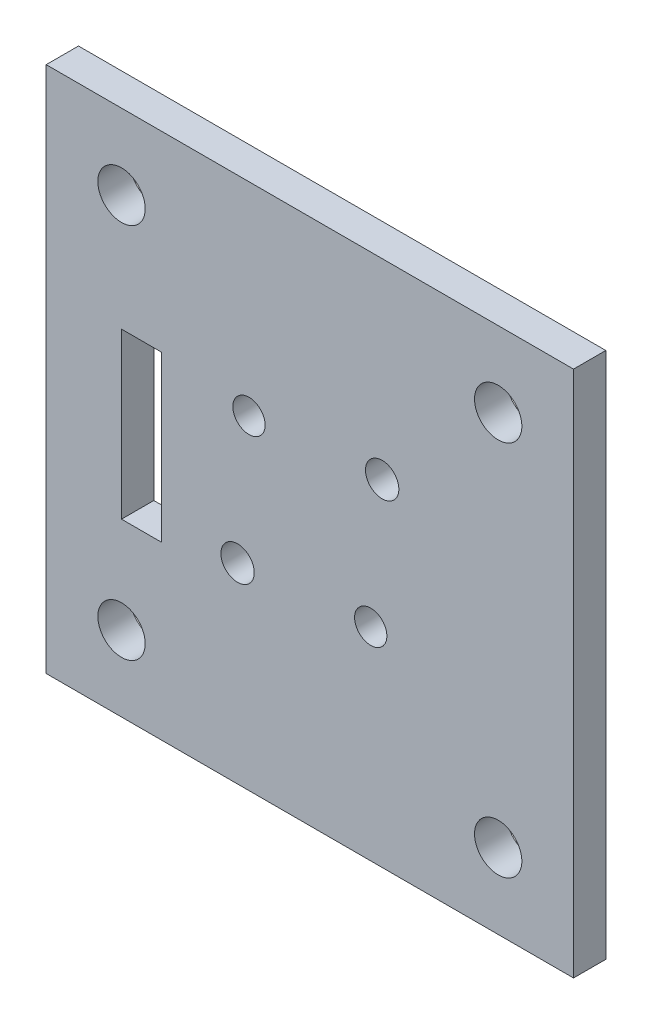
from build123d import *

# Parameters (mm, degrees)
SKETCH1_W           = 49
SKETCH1_H           = 49
SKETCH1_R           = 2.2
BOSS_EXTRUDE1_DEPTH = 3
SKETCH2_R           = 1.55
SKETCH2_R_2         = 1.5
SKETCH2_W           = 3.699471197
SKETCH2_H           = 15.29419199
CUT_EXTRUDE1_DEPTH  = 3


with BuildPart() as part:
    # Sketch1 → Boss-Extrude1 (new body)
    with BuildSketch(Plane.XY):
        Rectangle(SKETCH1_W, SKETCH1_H)
        with Locations((-17.5, -17.5)):
            Circle(SKETCH1_R, mode=Mode.SUBTRACT)
        with Locations((17.5, 17.5)):
            Circle(SKETCH1_R, mode=Mode.SUBTRACT)
        with Locations((17.5, -17.5)):
            Circle(SKETCH1_R, mode=Mode.SUBTRACT)
        with Locations((-17.5, 17.5)):
            Circle(SKETCH1_R, mode=Mode.SUBTRACT)
    extrude(amount=BOSS_EXTRUDE1_DEPTH)

    # Sketch2 → Cut-Extrude1 (cut)
    with BuildSketch(Plane(origin=(0, 0, 0), x_dir=(-1, 0, 0), z_dir=(0, 0, -1))):
        with Locations((-6.717514421, 6.717514421)):
            Circle(SKETCH2_R)
        with Locations((5.656854249, 5.656854249)):
            Circle(SKETCH2_R_2)
        with Locations((6.717514421, -6.717514421)):
            Circle(SKETCH2_R)
        with Locations((-5.656854249, -5.656854249)):
            Circle(SKETCH2_R_2)
        with Locations((15.650264401, -0.929581574)):
            Rectangle(SKETCH2_W, SKETCH2_H)
    extrude(amount=-CUT_EXTRUDE1_DEPTH, mode=Mode.SUBTRACT)


solid = part.part
